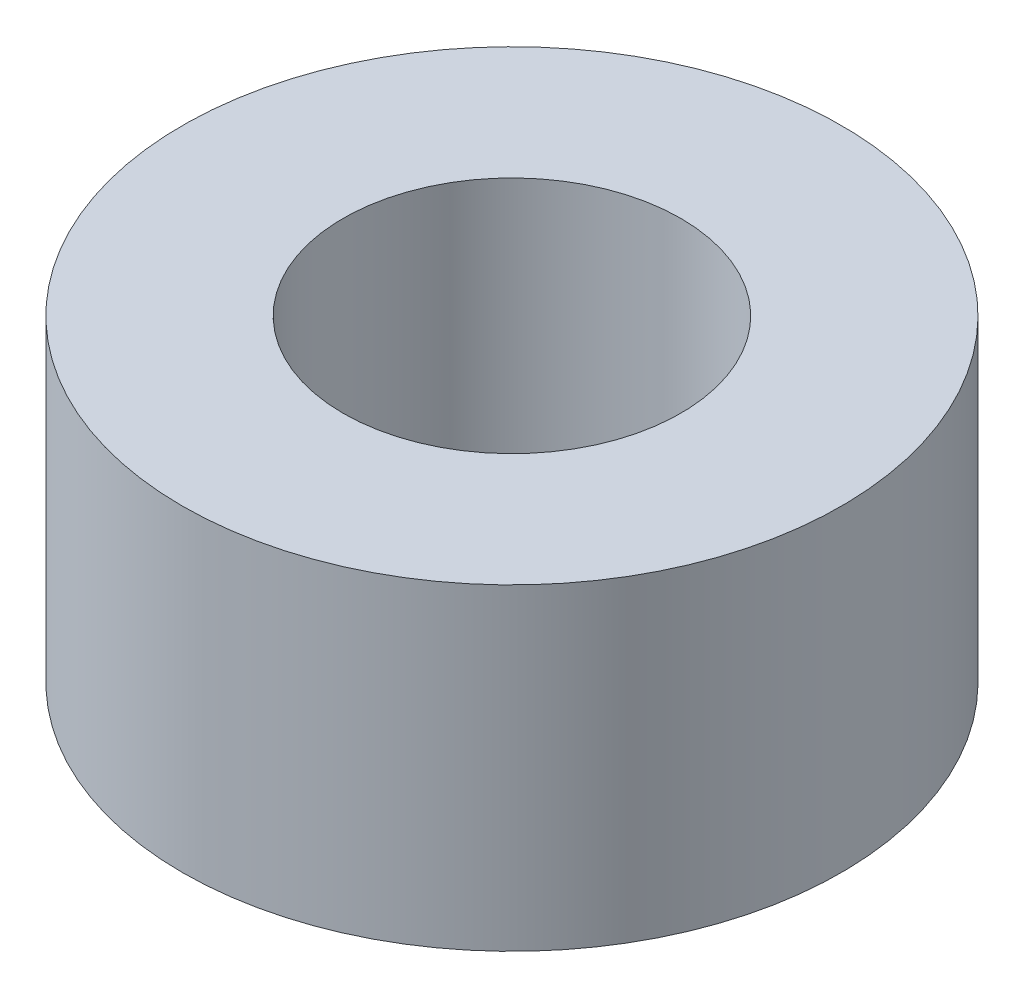
from build123d import *

# Parameters (mm, degrees)
SKIZZE2_R                       = 4.05
AUFSATZ_LINEAR_AUSTRAGEN1_DEPTH = 3.9
SKIZZE3_R                       = 2.075
SCHNITT_LINEAR_AUSTRAGEN1_DEPTH = 3.9


with BuildPart() as part:
    # Skizze2 → Aufsatz-Linear austragen1 (new body)
    with BuildSketch(Plane(origin=(0, 0, 0), x_dir=(1, 0, 0), z_dir=(0, 1, 0))):
        with Locations(Location((0, 0, 0), (0, 0, 270))):
            Circle(SKIZZE2_R)
    extrude(amount=AUFSATZ_LINEAR_AUSTRAGEN1_DEPTH)

    # Skizze3 → Schnitt-Linear austragen1 (cut)
    with BuildSketch(Plane.XZ):
        with Locations(Location((0, 0, 0), (0, 0, 270))):
            Circle(SKIZZE3_R)
    extrude(amount=-SCHNITT_LINEAR_AUSTRAGEN1_DEPTH, mode=Mode.SUBTRACT)


solid = part.part
